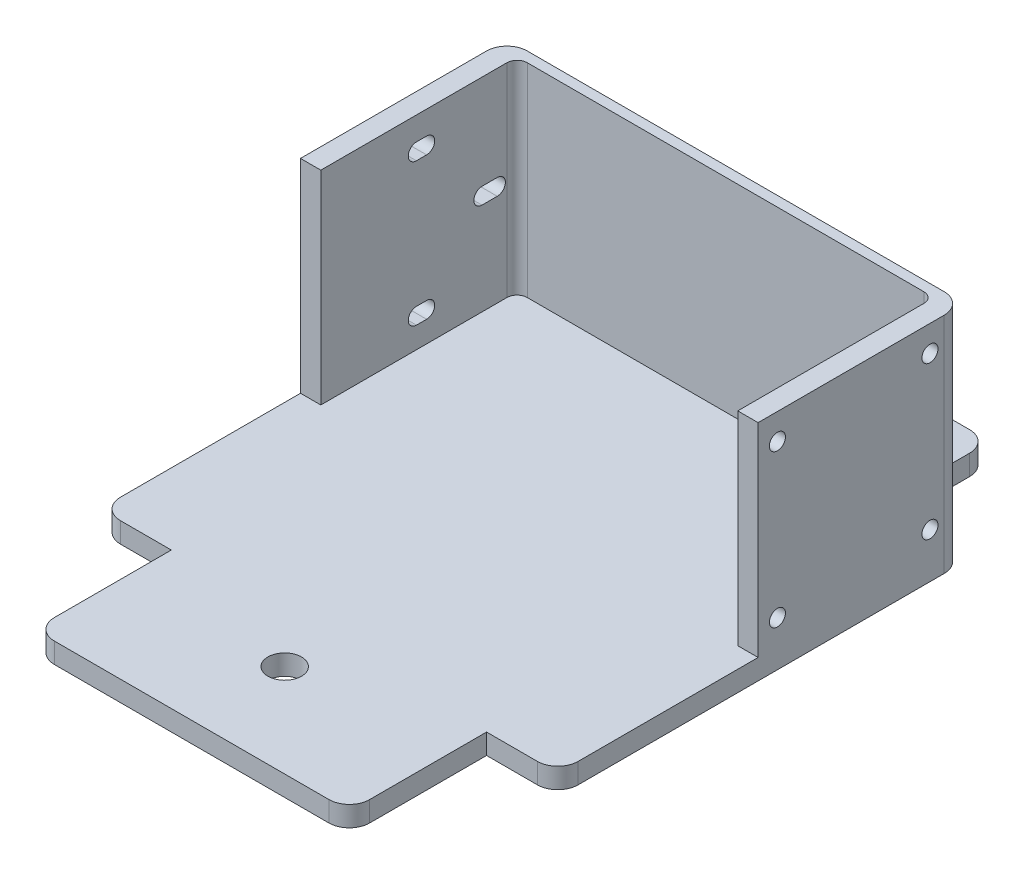
from build123d import *

# Parameters (mm, degrees)
SKETCH_1_W          = 45
SKETCH_1_H          = 40
EXTRUDE_1_DEPTH     = 2
EXTRUDE_2_DEPTH     = 20
SKETCH_3_W          = 31
SKETCH_3_H          = 63
EXTRUDE_3_DEPTH     = 2
SKETCH_4_R          = 1.65
CUT_EXTRUDE_1_DEPTH = 2
FILLET_2_R          = 2
EXTRUDE_4_DEPTH     = 20
CUT_EXTRUDE_2_DEPTH = 2.5
CUT_EXTRUDE_5_REACH = 62.26
SKETCH_11_W         = 2
SKETCH_11_H         = 20
FILLET_5_R          = 1
CUT_EXTRUDE_6_DEPTH = 2.5


with BuildPart() as part:
    # 草图1 → 凸台-拉伸1 (new body)
    with BuildSketch(Plane(origin=(0, 0, 0), x_dir=(1, 0, 0), z_dir=(0, 1, 0))):
        Rectangle(SKETCH_1_W, SKETCH_1_H)
    extrude(amount=EXTRUDE_1_DEPTH)

    # 草图2 → 凸台-拉伸2 (add)
    with BuildSketch(Plane(origin=(0, 2, 0), x_dir=(1, 0, 0), z_dir=(0, 1, 0))):
        Polygon((21.5, -2.3), (22.5, -2.3), (22.5, 20), (-22.5, 20), (-22.5, -2.3), (-21.5, -2.3), (-21.5, 19), (21.5, 19), align=None)
    extrude(amount=EXTRUDE_2_DEPTH)

    # 草图3 → 凸台-拉伸3 (add)
    with BuildSketch(Plane.XZ):
        with Locations((0, 2)):
            Rectangle(SKETCH_3_W, SKETCH_3_H)
    extrude(amount=-EXTRUDE_3_DEPTH)

    # 草图4 → 切除-拉伸1 (cut)
    with BuildSketch(Plane.XZ):
        with Locations(Location((0, -23.15, 0), (0, 0, 270))):
            Circle(SKETCH_4_R)
        with Locations(Location((0, 24.35, 0), (0, 0, 90))):
            Circle(SKETCH_4_R)
    extrude(amount=-CUT_EXTRUDE_1_DEPTH, mode=Mode.SUBTRACT)

    # 圆角2
    fillet_2_edges = [part.edges().sort_by_distance(p)[0] for p in [
        (-15.5, 1, -29.5),
        (15.5, 1, 33.5),
        (-15.5, 1, 33.5),
        (15.5, 1, -29.5),
        (22.5, 1, 20),
        (-22.5, 1, 20),
        (-22.5, 11, -20),
        (22.5, 11, -20),
    ]]
    fillet(fillet_2_edges, radius=FILLET_2_R)

    # 草图7 → 凸台-拉伸4 (add)
    with BuildSketch(Plane(origin=(0, 2, 0), x_dir=(1, 0, 0), z_dir=(0, 1, 0))):
        Polygon((20.5, 18), (20.5, -2.3), (21.5, -2.3), (21.5, 19), (20.5, 19), align=None)
        Polygon((-21.5, 19), (-21.5, -2.3), (-20.5, -2.3), (-20.5, 18), (-20.5, 19), align=None)
    extrude(amount=EXTRUDE_4_DEPTH)

    # 草图8 → 切除-拉伸2 (cut)
    with BuildSketch(Plane(origin=(20, 1.9, 0.9), x_dir=(0, 1, 0), z_dir=(1, 0, 0))):
        with BuildLine():
            ThreePointArc((18.33276934, -17.5), (17.54276934, -16.71), (16.75276934, -17.5))
            ThreePointArc((16.75276934, -17.5), (17.54276934, -18.29), (18.33276934, -17.5))
        make_face()
        with BuildLine():
            ThreePointArc((3.33276934, -17.5), (2.54276934, -16.71), (1.75276934, -17.5))
            ThreePointArc((1.75276934, -17.5), (2.54276934, -18.29), (3.33276934, -17.5))
        make_face()
        with BuildLine():
            ThreePointArc((3.33276934, -2.5), (2.54276934, -1.71), (1.75276934, -2.5))
            ThreePointArc((1.75276934, -2.5), (2.54276934, -3.29), (3.33276934, -2.5))
        make_face()
        with BuildLine():
            ThreePointArc((18.33276934, -2.5), (17.54276934, -1.71), (16.75276934, -2.5))
            ThreePointArc((16.75276934, -2.5), (17.54276934, -3.29), (18.33276934, -2.5))
        make_face()
    extrude(amount=CUT_EXTRUDE_2_DEPTH, mode=Mode.SUBTRACT)

    # 切除-拉伸5: up to this face of the body (flat: up to its plane)
    cut_extrude_5_end = Plane(part.part.faces().sort_by_distance((22.5, 10.316412164, -6.626998027))[0])
    # 草图11 → 切除-拉伸5 (cut, up to the picked face)
    with BuildSketch(Plane.ZY.offset(22.5), mode=Mode.PRIVATE) as cut_extrude_5_sk1:
        with Locations((1.3, 12)):
            Rectangle(SKETCH_11_W, SKETCH_11_H)
    cut_extrude_5_tool1 = split(extrude(cut_extrude_5_sk1.sketch, amount=-CUT_EXTRUDE_5_REACH, mode=Mode.PRIVATE), bisect_by=cut_extrude_5_end, keep=Keep.BOTH, mode=Mode.PRIVATE)
    add(cut_extrude_5_tool1.solids().sort_by(Axis((-22.5, 12, 1.3), (1, 0, 0)))[0], mode=Mode.SUBTRACT)

    # 圆角5
    fillet_5_edges = [part.edges().sort_by_distance(p)[0] for p in [
        (20.5, 12, -19),
        (-20.5, 12, -19),
    ]]
    fillet(fillet_5_edges, radius=FILLET_5_R)

    # 草图12 → 切除-拉伸6 (cut)
    with BuildSketch(Plane(origin=(-20, 1.9, 0.9), x_dir=(0, -1, 0), z_dir=(-1, 0, 0))):
        with BuildLine():
            Line((-10.8, -17.95), (-10.8, -16.45))
            ThreePointArc((-10.8, -16.45), (-10, -15.65), (-9.2, -16.45))
            Line((-9.2, -16.45), (-9.2, -17.95))
            ThreePointArc((-9.2, -17.95), (-10, -18.75), (-10.8, -17.95))
        make_face()
        with BuildLine():
            Line((-3.8, -11.0010906), (-3.8, -10.0010906))
            ThreePointArc((-3.8, -10.0010906), (-3, -9.2010906), (-2.2, -10.0010906))
            Line((-2.2, -10.0010906), (-2.2, -11.0010906))
            ThreePointArc((-2.2, -11.0010906), (-3, -11.8010906), (-3.8, -11.0010906))
        make_face()
        with BuildLine():
            Line((-17.8, -11.0010906), (-17.8, -10.0010906))
            ThreePointArc((-17.8, -10.0010906), (-17, -9.2010906), (-16.2, -10.0010906))
            Line((-16.2, -10.0010906), (-16.2, -11.0010906))
            ThreePointArc((-16.2, -11.0010906), (-17, -11.8010906), (-17.8, -11.0010906))
        make_face()
    extrude(amount=CUT_EXTRUDE_6_DEPTH, mode=Mode.SUBTRACT)


solid = part.part
